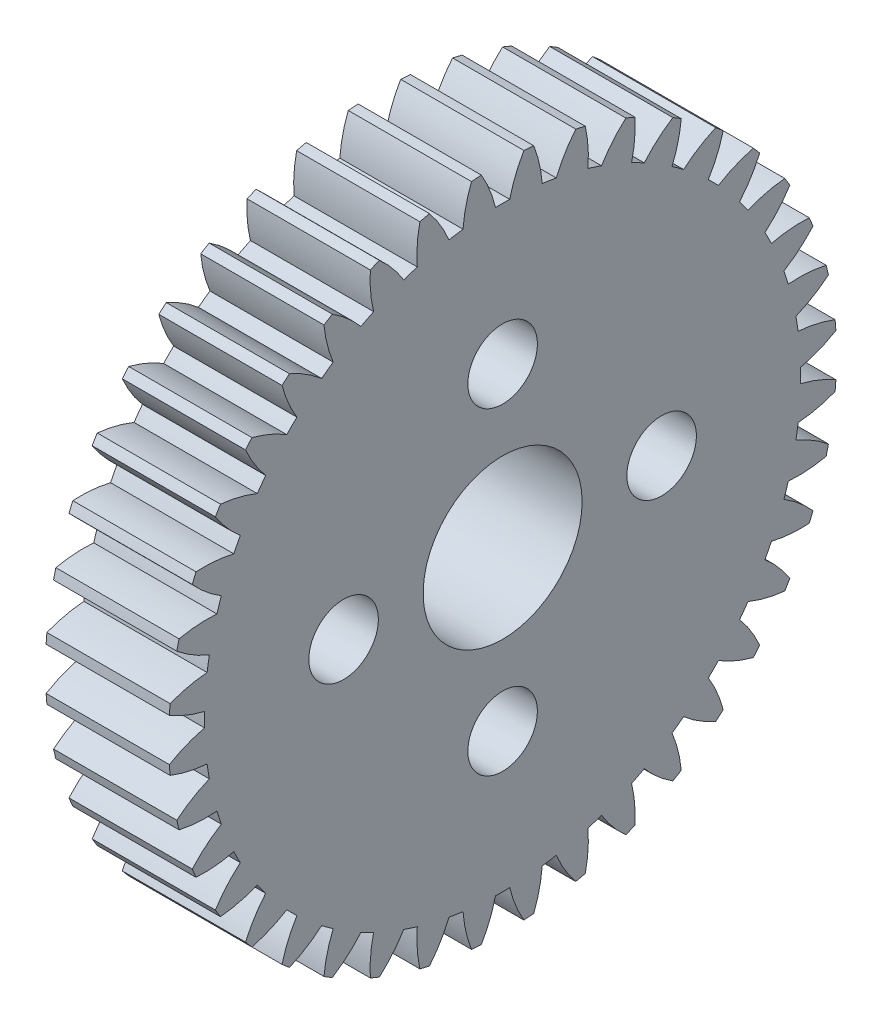
from build123d import *

# Parameters (mm, degrees)
SKETCH1_R           = 1.75
SKETCH1_R_2         = 4
BOSS_EXTRUDE1_DEPTH = 6.2


with BuildPart() as part:
    # Sketch1 → Boss-Extrude1 (new body)
    with BuildSketch(Plane(origin=(0, 0, 0), x_dir=(0, -1, 0), z_dir=(-1, 0, 0))):
        with BuildLine():
            ThreePointArc((-16.391771192, -3.68101035), (-16.335814663, -3.921882113), (-16.276318803, -4.161904158))
            ThreePointArc((-16.276318803, -4.161904158), (-15.328836725, -4.298843929), (-14.371528142, -4.292922065))
            ThreePointArc((-14.371528142, -4.292922065), (-14.264896688, -4.634945899), (-14.150126781, -4.974325389))
            ThreePointArc((-14.150126781, -4.974325389), (-14.928086477, -5.532226367), (-15.614124403, -6.199928961))
            ThreePointArc((-15.614124403, -6.199928961), (-15.521176146, -6.429081664), (-15.424865059, -6.656841436))
            ThreePointArc((-15.424865059, -6.656841436), (-14.467625957, -6.643876399), (-13.523029816, -6.488271387))
            ThreePointArc((-13.523029816, -6.488271387), (-13.364206856, -6.809403506), (-13.197759308, -7.126650702))
            ThreePointArc((-13.197759308, -7.126650702), (-13.878866089, -7.799382702), (-14.452006051, -8.566184746))
            ThreePointArc((-14.452006051, -8.566184746), (-14.324354761, -8.777975887), (-14.193599945, -8.987865186))
            ThreePointArc((-14.193599945, -8.987865186), (-13.250174224, -8.825314583), (-12.341549615, -8.523857935))
            ThreePointArc((-12.341549615, -8.523857935), (-12.134445899, -8.816190999), (-11.920419201, -9.103494223))
            ThreePointArc((-11.920419201, -9.103494223), (-12.487901956, -9.874492351), (-12.934031347, -10.721512632))
            ThreePointArc((-12.934031347, -10.721512632), (-12.774820222, -10.910727212), (-12.612841295, -11.097577865))
            ThreePointArc((-12.612841295, -11.097577865), (-11.706459226, -10.789444232), (-10.856179504, -10.349558811))
            ThreePointArc((-10.856179504, -10.349558811), (-10.605894611, -10.605894611), (-10.349558811, -10.856179504))
            ThreePointArc((-10.349558811, -10.856179504), (-10.789444232, -11.706459226), (-11.097577865, -12.612841295))
            ThreePointArc((-11.097577865, -12.612841295), (-10.910727212, -12.774820222), (-10.721512632, -12.934031347))
            ThreePointArc((-10.721512632, -12.934031347), (-9.874492351, -12.487901956), (-9.103494223, -11.920419201))
            ThreePointArc((-9.103494223, -11.920419201), (-8.816190999, -12.134445899), (-8.523857935, -12.341549615))
            ThreePointArc((-8.523857935, -12.341549615), (-8.825314583, -13.250174224), (-8.987865186, -14.193599945))
            ThreePointArc((-8.987865186, -14.193599945), (-8.777975887, -14.324354761), (-8.566184746, -14.452006051))
            ThreePointArc((-8.566184746, -14.452006051), (-7.799382702, -13.878866089), (-7.126650702, -13.197759308))
            ThreePointArc((-7.126650702, -13.197759308), (-6.809403506, -13.364206856), (-6.488271387, -13.523029816))
            ThreePointArc((-6.488271387, -13.523029816), (-6.643876399, -14.467625957), (-6.656841436, -15.424865059))
            ThreePointArc((-6.656841436, -15.424865059), (-6.429081664, -15.521176146), (-6.199928961, -15.614124403))
            ThreePointArc((-6.199928961, -15.614124403), (-5.532226367, -14.928086477), (-4.974325389, -14.150126781))
            ThreePointArc((-4.974325389, -14.150126781), (-4.634945899, -14.264896688), (-4.292922065, -14.371528142))
            ThreePointArc((-4.292922065, -14.371528142), (-4.298843929, -15.328836725), (-4.161904158, -16.276318803))
            ThreePointArc((-4.161904158, -16.276318803), (-3.921882113, -16.335814663), (-3.68101035, -16.391771192))
            ThreePointArc((-3.68101035, -16.391771192), (-3.128848258, -15.609727833), (-2.699515676, -14.754071171))
            ThreePointArc((-2.699515676, -14.754071171), (-2.346360541, -14.814337421), (-1.991866754, -14.866151749))
            ThreePointArc((-1.991866754, -14.866151749), (-1.847959654, -15.812600658), (-1.564486987, -16.72699556))
            ThreePointArc((-1.564486987, -16.72699556), (-1.318112808, -16.748211207), (-1.071453046, -16.765798173))
            ThreePointArc((-1.071453046, -16.765798173), (-0.648427521, -15.907005884), (-0.358234928, -14.994721362))
            ThreePointArc((-0.358234928, -14.994721362), (0, -14.999), (0.358234928, -14.994721362))
            ThreePointArc((0.358234928, -14.994721362), (0.648427521, -15.907005884), (1.071453046, -16.765798173))
            ThreePointArc((1.071453046, -16.765798173), (1.318112808, -16.748211207), (1.564486987, -16.72699556))
            ThreePointArc((1.564486987, -16.72699556), (1.847959654, -15.812600658), (1.991866754, -14.866151749))
            ThreePointArc((1.991866754, -14.866151749), (2.346360541, -14.814337421), (2.699515676, -14.754071171))
            ThreePointArc((2.699515676, -14.754071171), (3.128848258, -15.609727833), (3.68101035, -16.391771192))
            ThreePointArc((3.68101035, -16.391771192), (3.921882113, -16.335814663), (4.161904158, -16.276318803))
            ThreePointArc((4.161904158, -16.276318803), (4.298843929, -15.328836725), (4.292922065, -14.371528142))
            ThreePointArc((4.292922065, -14.371528142), (4.634945899, -14.264896688), (4.974325389, -14.150126781))
            ThreePointArc((4.974325389, -14.150126781), (5.532226367, -14.928086477), (6.199928961, -15.614124403))
            ThreePointArc((6.199928961, -15.614124403), (6.429081664, -15.521176146), (6.656841436, -15.424865059))
            ThreePointArc((6.656841436, -15.424865059), (6.643876399, -14.467625957), (6.488271387, -13.523029816))
            ThreePointArc((6.488271387, -13.523029816), (6.809403506, -13.364206856), (7.126650702, -13.197759308))
            ThreePointArc((7.126650702, -13.197759308), (7.799382702, -13.878866089), (8.566184746, -14.452006051))
            ThreePointArc((8.566184746, -14.452006051), (8.777975887, -14.324354761), (8.987865186, -14.193599945))
            ThreePointArc((8.987865186, -14.193599945), (8.825314583, -13.250174224), (8.523857935, -12.341549615))
            ThreePointArc((8.523857935, -12.341549615), (8.816190999, -12.134445899), (9.103494223, -11.920419201))
            ThreePointArc((9.103494223, -11.920419201), (9.874492351, -12.487901956), (10.721512632, -12.934031347))
            ThreePointArc((10.721512632, -12.934031347), (10.910727212, -12.774820222), (11.097577865, -12.612841295))
            ThreePointArc((11.097577865, -12.612841295), (10.789444232, -11.706459226), (10.349558811, -10.856179504))
            ThreePointArc((10.349558811, -10.856179504), (10.605894611, -10.605894611), (10.856179504, -10.349558811))
            ThreePointArc((10.856179504, -10.349558811), (11.706459226, -10.789444232), (12.612841295, -11.097577865))
            ThreePointArc((12.612841295, -11.097577865), (12.774820222, -10.910727212), (12.934031347, -10.721512632))
            ThreePointArc((12.934031347, -10.721512632), (12.487901956, -9.874492351), (11.920419201, -9.103494223))
            ThreePointArc((11.920419201, -9.103494223), (12.134445899, -8.816190999), (12.341549615, -8.523857935))
            ThreePointArc((12.341549615, -8.523857935), (13.250174224, -8.825314583), (14.193599945, -8.987865186))
            ThreePointArc((14.193599945, -8.987865186), (14.324354761, -8.777975887), (14.452006051, -8.566184746))
            ThreePointArc((14.452006051, -8.566184746), (13.878866089, -7.799382702), (13.197759308, -7.126650702))
            ThreePointArc((13.197759308, -7.126650702), (13.364206856, -6.809403506), (13.523029816, -6.488271387))
            ThreePointArc((13.523029816, -6.488271387), (14.467625957, -6.643876399), (15.424865059, -6.656841436))
            ThreePointArc((15.424865059, -6.656841436), (15.521176146, -6.429081664), (15.614124403, -6.199928961))
            ThreePointArc((15.614124403, -6.199928961), (14.928086477, -5.532226367), (14.150126781, -4.974325389))
            ThreePointArc((14.150126781, -4.974325389), (14.264896688, -4.634945899), (14.371528142, -4.292922065))
            ThreePointArc((14.371528142, -4.292922065), (15.328836725, -4.298843929), (16.276318803, -4.161904158))
            ThreePointArc((16.276318803, -4.161904158), (16.335814663, -3.921882113), (16.391771192, -3.68101035))
            ThreePointArc((16.391771192, -3.68101035), (15.609727833, -3.128848258), (14.754071171, -2.699515676))
            ThreePointArc((14.754071171, -2.699515676), (14.814337421, -2.346360541), (14.866151749, -1.991866754))
            ThreePointArc((14.866151749, -1.991866754), (15.812600658, -1.847959654), (16.72699556, -1.564486987))
            ThreePointArc((16.72699556, -1.564486987), (16.748211207, -1.318112808), (16.765798173, -1.071453046))
            ThreePointArc((16.765798173, -1.071453046), (15.907005884, -0.648427521), (14.994721362, -0.358234928))
            ThreePointArc((14.994721362, -0.358234928), (14.999, 0), (14.994721362, 0.358234928))
            ThreePointArc((14.994721362, 0.358234928), (15.907005884, 0.648427521), (16.765798173, 1.071453046))
            ThreePointArc((16.765798173, 1.071453046), (16.748211207, 1.318112808), (16.72699556, 1.564486987))
            ThreePointArc((16.72699556, 1.564486987), (15.812600658, 1.847959654), (14.866151749, 1.991866754))
            ThreePointArc((14.866151749, 1.991866754), (14.814337421, 2.346360541), (14.754071171, 2.699515676))
            ThreePointArc((14.754071171, 2.699515676), (15.609727833, 3.128848258), (16.391771192, 3.68101035))
            ThreePointArc((16.391771192, 3.68101035), (16.335814663, 3.921882113), (16.276318803, 4.161904158))
            ThreePointArc((16.276318803, 4.161904158), (15.328836725, 4.298843929), (14.371528142, 4.292922065))
            ThreePointArc((14.371528142, 4.292922065), (14.264896688, 4.634945899), (14.150126781, 4.974325389))
            ThreePointArc((14.150126781, 4.974325389), (14.928086477, 5.532226367), (15.614124403, 6.199928961))
            ThreePointArc((15.614124403, 6.199928961), (15.521176146, 6.429081664), (15.424865059, 6.656841436))
            ThreePointArc((15.424865059, 6.656841436), (14.467625957, 6.643876399), (13.523029816, 6.488271387))
            ThreePointArc((13.523029816, 6.488271387), (13.364206856, 6.809403506), (13.197759308, 7.126650702))
            ThreePointArc((13.197759308, 7.126650702), (13.878866089, 7.799382702), (14.452006051, 8.566184746))
            ThreePointArc((14.452006051, 8.566184746), (14.324354761, 8.777975887), (14.193599945, 8.987865186))
            ThreePointArc((14.193599945, 8.987865186), (13.250174224, 8.825314583), (12.341549615, 8.523857935))
            ThreePointArc((12.341549615, 8.523857935), (12.134445899, 8.816190999), (11.920419201, 9.103494223))
            ThreePointArc((11.920419201, 9.103494223), (12.487901956, 9.874492351), (12.934031347, 10.721512632))
            ThreePointArc((12.934031347, 10.721512632), (12.774820222, 10.910727212), (12.612841295, 11.097577865))
            ThreePointArc((12.612841295, 11.097577865), (11.706459226, 10.789444232), (10.856179504, 10.349558811))
            ThreePointArc((10.856179504, 10.349558811), (10.605894611, 10.605894611), (10.349558811, 10.856179504))
            ThreePointArc((10.349558811, 10.856179504), (10.789444232, 11.706459226), (11.097577865, 12.612841295))
            ThreePointArc((11.097577865, 12.612841295), (10.910727212, 12.774820222), (10.721512632, 12.934031347))
            ThreePointArc((10.721512632, 12.934031347), (9.874492351, 12.487901956), (9.103494223, 11.920419201))
            ThreePointArc((9.103494223, 11.920419201), (8.816190999, 12.134445899), (8.523857935, 12.341549615))
            ThreePointArc((8.523857935, 12.341549615), (8.825314583, 13.250174224), (8.987865186, 14.193599945))
            ThreePointArc((8.987865186, 14.193599945), (8.777975887, 14.324354761), (8.566184746, 14.452006051))
            ThreePointArc((8.566184746, 14.452006051), (7.799382702, 13.878866089), (7.126650702, 13.197759308))
            ThreePointArc((7.126650702, 13.197759308), (6.809403506, 13.364206856), (6.488271387, 13.523029816))
            ThreePointArc((6.488271387, 13.523029816), (6.643876399, 14.467625957), (6.656841436, 15.424865059))
            ThreePointArc((6.656841436, 15.424865059), (6.429081664, 15.521176146), (6.199928961, 15.614124403))
            ThreePointArc((6.199928961, 15.614124403), (5.532226367, 14.928086477), (4.974325389, 14.150126781))
            ThreePointArc((4.974325389, 14.150126781), (4.634945899, 14.264896688), (4.292922065, 14.371528142))
            ThreePointArc((4.292922065, 14.371528142), (4.298843929, 15.328836725), (4.161904158, 16.276318803))
            ThreePointArc((4.161904158, 16.276318803), (3.921882113, 16.335814663), (3.68101035, 16.391771192))
            ThreePointArc((3.68101035, 16.391771192), (3.128848258, 15.609727833), (2.699515676, 14.754071171))
            ThreePointArc((2.699515676, 14.754071171), (2.346360541, 14.814337421), (1.991866754, 14.866151749))
            ThreePointArc((1.991866754, 14.866151749), (1.847959654, 15.812600658), (1.564486987, 16.72699556))
            ThreePointArc((1.564486987, 16.72699556), (1.318112808, 16.748211207), (1.071453046, 16.765798173))
            ThreePointArc((1.071453046, 16.765798173), (0.648427521, 15.907005884), (0.358234928, 14.994721362))
            ThreePointArc((0.358234928, 14.994721362), (0, 14.999), (-0.358234928, 14.994721362))
            ThreePointArc((-0.358234928, 14.994721362), (-0.648427521, 15.907005884), (-1.071453046, 16.765798173))
            ThreePointArc((-1.071453046, 16.765798173), (-1.318112808, 16.748211207), (-1.564486987, 16.72699556))
            ThreePointArc((-1.564486987, 16.72699556), (-1.847959654, 15.812600658), (-1.991866754, 14.866151749))
            ThreePointArc((-1.991866754, 14.866151749), (-2.346360541, 14.814337421), (-2.699515676, 14.754071171))
            ThreePointArc((-2.699515676, 14.754071171), (-3.128848258, 15.609727833), (-3.68101035, 16.391771192))
            ThreePointArc((-3.68101035, 16.391771192), (-3.921882113, 16.335814663), (-4.161904158, 16.276318803))
            ThreePointArc((-4.161904158, 16.276318803), (-4.298843929, 15.328836725), (-4.292922065, 14.371528142))
            ThreePointArc((-4.292922065, 14.371528142), (-4.634945899, 14.264896688), (-4.974325389, 14.150126781))
            ThreePointArc((-4.974325389, 14.150126781), (-5.532226367, 14.928086477), (-6.199928961, 15.614124403))
            ThreePointArc((-6.199928961, 15.614124403), (-6.429081664, 15.521176146), (-6.656841436, 15.424865059))
            ThreePointArc((-6.656841436, 15.424865059), (-6.643876399, 14.467625957), (-6.488271387, 13.523029816))
            ThreePointArc((-6.488271387, 13.523029816), (-6.809403506, 13.364206856), (-7.126650702, 13.197759308))
            ThreePointArc((-7.126650702, 13.197759308), (-7.799382702, 13.878866089), (-8.566184746, 14.452006051))
            ThreePointArc((-8.566184746, 14.452006051), (-8.777975887, 14.324354761), (-8.987865186, 14.193599945))
            ThreePointArc((-8.987865186, 14.193599945), (-8.825314583, 13.250174224), (-8.523857935, 12.341549615))
            ThreePointArc((-8.523857935, 12.341549615), (-8.816190999, 12.134445899), (-9.103494223, 11.920419201))
            ThreePointArc((-9.103494223, 11.920419201), (-9.874492351, 12.487901956), (-10.721512632, 12.934031347))
            ThreePointArc((-10.721512632, 12.934031347), (-10.910727212, 12.774820222), (-11.097577865, 12.612841295))
            ThreePointArc((-11.097577865, 12.612841295), (-10.789444232, 11.706459226), (-10.349558811, 10.856179504))
            ThreePointArc((-10.349558811, 10.856179504), (-10.605894611, 10.605894611), (-10.856179504, 10.349558811))
            ThreePointArc((-10.856179504, 10.349558811), (-11.706459226, 10.789444232), (-12.612841295, 11.097577865))
            ThreePointArc((-12.612841295, 11.097577865), (-12.774820222, 10.910727212), (-12.934031347, 10.721512632))
            ThreePointArc((-12.934031347, 10.721512632), (-12.487901956, 9.874492351), (-11.920419201, 9.103494223))
            ThreePointArc((-11.920419201, 9.103494223), (-12.134445899, 8.816190999), (-12.341549615, 8.523857935))
            ThreePointArc((-12.341549615, 8.523857935), (-13.250174224, 8.825314583), (-14.193599945, 8.987865186))
            ThreePointArc((-14.193599945, 8.987865186), (-14.324354761, 8.777975887), (-14.452006051, 8.566184746))
            ThreePointArc((-14.452006051, 8.566184746), (-13.878866089, 7.799382702), (-13.197759308, 7.126650702))
            ThreePointArc((-13.197759308, 7.126650702), (-13.364206856, 6.809403506), (-13.523029816, 6.488271387))
            ThreePointArc((-13.523029816, 6.488271387), (-14.467625957, 6.643876399), (-15.424865059, 6.656841436))
            ThreePointArc((-15.424865059, 6.656841436), (-15.521176146, 6.429081664), (-15.614124403, 6.199928961))
            ThreePointArc((-15.614124403, 6.199928961), (-14.928086477, 5.532226367), (-14.150126781, 4.974325389))
            ThreePointArc((-14.150126781, 4.974325389), (-14.264896688, 4.634945899), (-14.371528142, 4.292922065))
            ThreePointArc((-14.371528142, 4.292922065), (-15.328836725, 4.298843929), (-16.276318803, 4.161904158))
            ThreePointArc((-16.276318803, 4.161904158), (-16.335814663, 3.921882113), (-16.391771192, 3.68101035))
            ThreePointArc((-16.391771192, 3.68101035), (-15.609727833, 3.128848258), (-14.754071171, 2.699515676))
            ThreePointArc((-14.754071171, 2.699515676), (-14.814337421, 2.346360541), (-14.866151749, 1.991866754))
            ThreePointArc((-14.866151749, 1.991866754), (-15.812600658, 1.847959654), (-16.72699556, 1.564486987))
            ThreePointArc((-16.72699556, 1.564486987), (-16.748211207, 1.318112808), (-16.765798173, 1.071453046))
            ThreePointArc((-16.765798173, 1.071453046), (-15.907005884, 0.648427521), (-14.994721362, 0.358234928))
            ThreePointArc((-14.994721362, 0.358234928), (-14.999, 0), (-14.994721362, -0.358234928))
            ThreePointArc((-14.994721362, -0.358234928), (-15.907005884, -0.648427521), (-16.765798173, -1.071453046))
            ThreePointArc((-16.765798173, -1.071453046), (-16.748211207, -1.318112808), (-16.72699556, -1.564486987))
            ThreePointArc((-16.72699556, -1.564486987), (-15.812600658, -1.847959654), (-14.866151749, -1.991866754))
            ThreePointArc((-14.866151749, -1.991866754), (-14.814337421, -2.346360541), (-14.754071171, -2.699515676))
            ThreePointArc((-14.754071171, -2.699515676), (-15.609727833, -3.128848258), (-16.391771192, -3.68101035))
        make_face()
        with Locations(Location((-8, 0, 0), (0, 0, 270))):
            Circle(SKETCH1_R, mode=Mode.SUBTRACT)
        with Locations(Location((8, 0, 0), (0, 0, 270))):
            Circle(SKETCH1_R, mode=Mode.SUBTRACT)
        with Locations(Location((0, -8, 0), (0, 0, 270))):
            Circle(SKETCH1_R, mode=Mode.SUBTRACT)
        with Locations(Location((0, 8, 0), (0, 0, 270))):
            Circle(SKETCH1_R, mode=Mode.SUBTRACT)
        with Locations(Location((0, 0, 0), (0, 0, 270))):
            Circle(SKETCH1_R_2, mode=Mode.SUBTRACT)
    extrude(amount=-BOSS_EXTRUDE1_DEPTH)


solid = part.part
